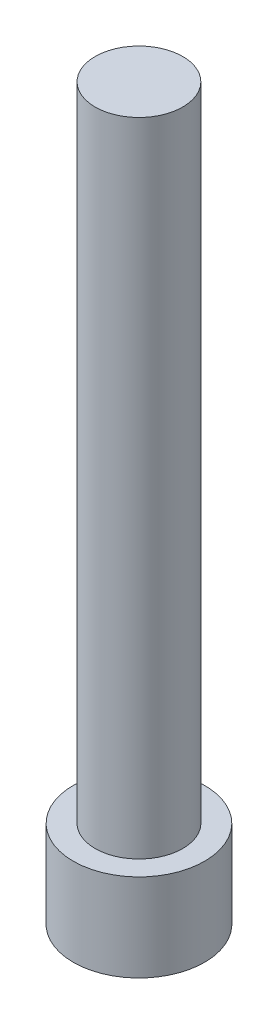
from build123d import *

# Parameters (mm, degrees)
SKETCH_1_R          = 2.25
EXTRUDE_1_DEPTH     = 3
SKETCH_2_R          = 1.5
EXTRUDE_2_DEPTH     = 22
CUT_EXTRUDE_1_DEPTH = 2
FILLET_1_R          = 0.1


with BuildPart() as part:
    # 草图1 → 凸台-拉伸1 (new body)
    with BuildSketch(Plane(origin=(0, 0, 0), x_dir=(1, 0, 0), z_dir=(0, 1, 0))):
        with Locations(Location((0, 0, 0), (0, 0, 270))):
            Circle(SKETCH_1_R)
    extrude(amount=EXTRUDE_1_DEPTH)

    # 草图2 → 凸台-拉伸2 (add)
    with BuildSketch(Plane(origin=(0, 3, 0), x_dir=(1, 0, 0), z_dir=(0, 1, 0))):
        with Locations(Location((0, 0, 0), (0, 0, 270))):
            Circle(SKETCH_2_R)
    extrude(amount=EXTRUDE_2_DEPTH)

    # 草图3 → 切除-拉伸1 (cut)
    with BuildSketch(Plane.XZ):
        Polygon((0.75, 1.299038106), (-0.75, 1.299038106), (-1.5, 0), (-0.75, -1.299038106), (0.75, -1.299038106), (1.5, 0), align=None)
    extrude(amount=-CUT_EXTRUDE_1_DEPTH, mode=Mode.SUBTRACT)

    # 圆角1
    fillet_1_edges = [part.edges().sort_by_distance(p)[0] for p in [
        (1.125, 0, 0.649519053),
        (0, 0, 1.299038106),
        (-1.125, 0, 0.649519053),
        (-1.125, 0, -0.649519053),
        (0, 0, -1.299038106),
        (1.125, 0, -0.649519053),
    ]]
    fillet(fillet_1_edges, radius=FILLET_1_R)


solid = part.part
